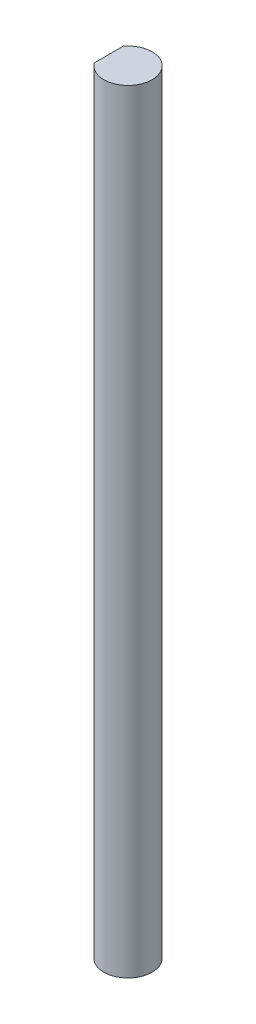
from build123d import *

# Parameters (mm, degrees)
BOSS_EXTRUDE1_DEPTH = 101.6


with BuildPart() as part:
    # Sketch1 → Boss-Extrude1 (new body)
    with BuildSketch(Plane(origin=(0, 0, 0), x_dir=(1, 0, 0), z_dir=(0, 1, 0))):
        with BuildLine():
            Line((-2.54, -1.905), (-2.54, 1.905))
            ThreePointArc((-2.54, 1.905), (3.175, 0), (-2.54, -1.905))
        make_face()
    extrude(amount=BOSS_EXTRUDE1_DEPTH)


solid = part.part
